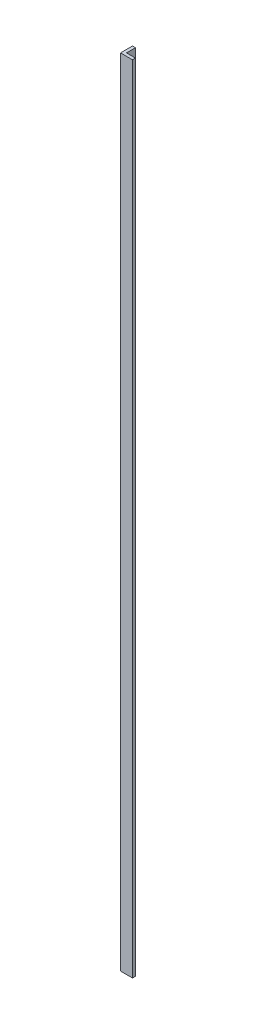
from build123d import *

# Parameters (mm, degrees)
BOSS_EXTRUDE1_DEPTH = 423.545


with BuildPart() as part:
    # Sketch1 → Boss-Extrude1 (new body)
    with BuildSketch(Plane(origin=(0, 0, 0), x_dir=(1, 0, 0), z_dir=(0, 1, 0))):
        Polygon((0, 0), (6.35, 0), (6.35, 1.5875), (1.5875, 1.5875), (1.5875, 6.35), (0, 6.35), align=None)
    extrude(amount=BOSS_EXTRUDE1_DEPTH)


solid = part.part
